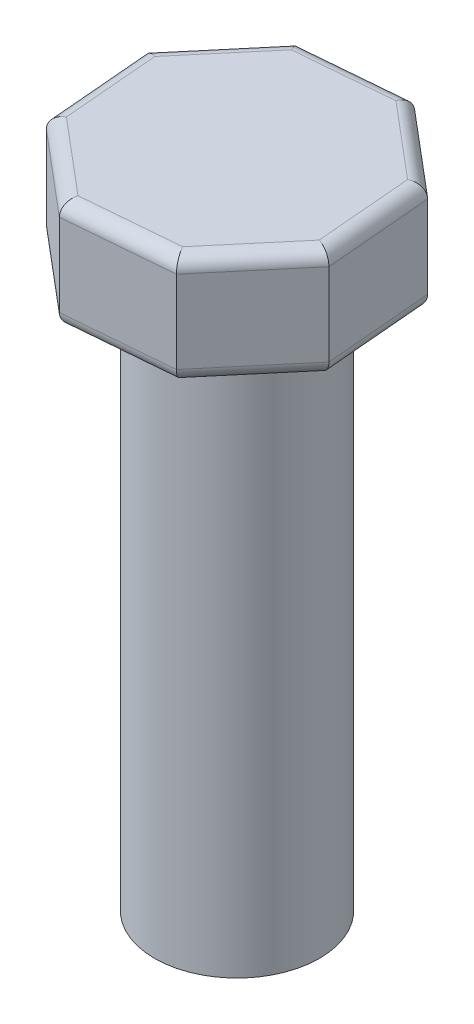
from build123d import *

# Parameters (mm, degrees)
BOSS_EXTRUDE1_DEPTH = 8
SKETCH2_R           = 6
BOSS_EXTRUDE2_DEPTH = 40
FILLET1_R           = 1


with BuildPart() as part:
    # Sketch1 → Boss-Extrude1 (new body)
    with BuildSketch(Plane(origin=(0, 0, 0), x_dir=(1, 0, 0), z_dir=(0, 1, 0))):
        Polygon((9.799334365, -3.115685798), (9.132298337, 4.726053225), (3.115685798, 9.799334365), (-4.726053225, 9.132298337), (-9.799334365, 3.115685798), (-9.132298337, -4.726053225), (-3.115685798, -9.799334365), (4.726053225, -9.132298337), align=None)
    extrude(amount=BOSS_EXTRUDE1_DEPTH)

    # Sketch2 → Boss-Extrude2 (add)
    with BuildSketch(Plane.XZ):
        with Locations(Location((0, 0, 0), (0, 0, 90))):
            Circle(SKETCH2_R)
    extrude(amount=BOSS_EXTRUDE2_DEPTH)

    # Fillet1
    fillet1_edges = [part.edges().sort_by_distance(p)[0] for p in [
        (-9.465816351, 8, 0.805183713),
        (-7.262693795, 0, -6.123992067),
        (-0.805183713, 0, -9.465816351),
        (-6.123992067, 8, 7.262693795),
        (0.805183713, 8, 9.465816351),
        (7.262693795, 8, 6.123992067),
        (9.465816351, 8, -0.805183713),
        (6.123992067, 8, -7.262693795),
        (-0.805183713, 8, -9.465816351),
        (-7.262693795, 8, -6.123992067),
        (6.123992067, 0, -7.262693795),
        (9.465816351, 0, -0.805183713),
        (7.262693795, 0, 6.123992067),
        (0.805183713, 0, 9.465816351),
        (-6.123992067, 0, 7.262693795),
        (-9.465816351, 0, 0.805183713),
    ]]
    fillet(fillet1_edges, radius=FILLET1_R)


solid = part.part
